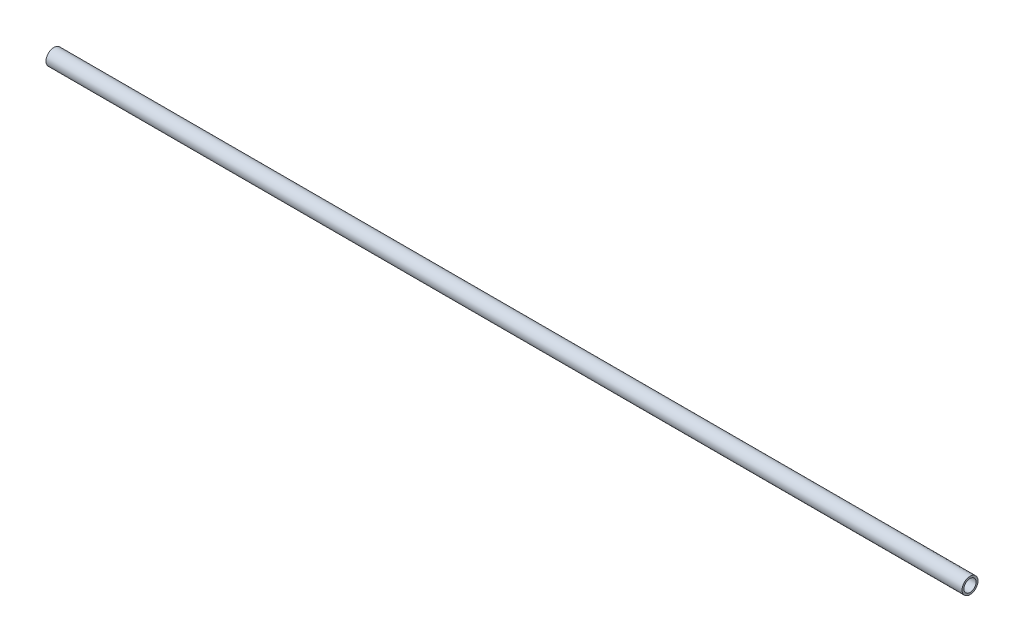
from build123d import *

# Parameters (mm, degrees)
SKETCH1_R           = 12.7
SKETCH1_R_2         = 9.652
BOSS_EXTRUDE1_DEPTH = 1460.5


with BuildPart() as part:
    # Sketch1 → Boss-Extrude1 (new body)
    with BuildSketch(Plane(origin=(0, 0, 0), x_dir=(0, 0, -1), z_dir=(1, 0, 0))):
        Circle(SKETCH1_R)
        Circle(SKETCH1_R_2, mode=Mode.SUBTRACT)
    extrude(amount=BOSS_EXTRUDE1_DEPTH)


solid = part.part
